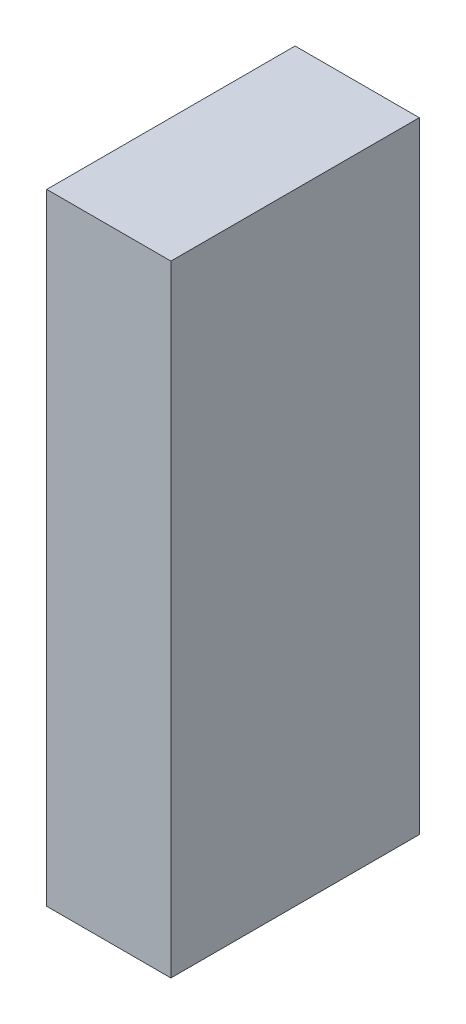
from build123d import *

# Parameters (mm, degrees)
SKETCH1_W           = 20
SKETCH1_H           = 100
BOSS_EXTRUDE1_DEPTH = 40


with BuildPart() as part:
    # Sketch1 → Boss-Extrude1 (new body)
    with BuildSketch(Plane.XY):
        with Locations((10, 50)):
            Rectangle(SKETCH1_W, SKETCH1_H)
    extrude(amount=BOSS_EXTRUDE1_DEPTH)


solid = part.part
